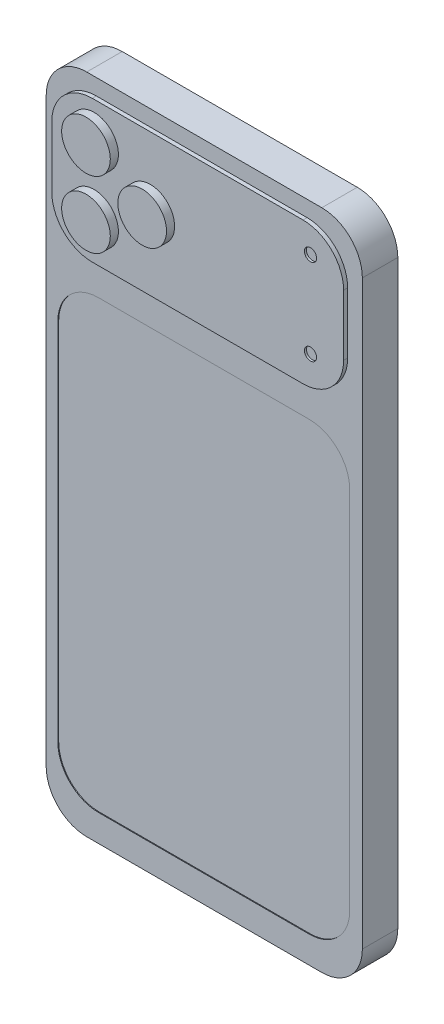
from build123d import *

# Parameters (mm, degrees)
BOSS_EXTRU_1_DEPTH      = 8.75
BOSS_EXTRU_2_DEPTH      = 1
ESQUISSE5_R             = 6
BOSS_EXTRU_3_DEPTH      = 2
ESQUISSE6_R             = 1.5
ENL_V_MAT_EXTRU_1_DEPTH = 0.5
ENL_V_MAT_EXTRU_2_DEPTH = 0.2


with BuildPart() as part:
    # Esquisse2 → Boss.-Extru.1 (new body)
    with BuildSketch(Plane.XY):
        with BuildLine():
            Line((10, 0), (68, 0))
            ThreePointArc((68, 0), (75.071067812, 2.928932188), (78, 10))
            Line((78, 10), (78, 153.4))
            ThreePointArc((78, 153.4), (75.071067812, 160.471067812), (68, 163.4))
            Line((68, 163.4), (10, 163.4))
            ThreePointArc((10, 163.4), (2.928932188, 160.471067812), (0, 153.4))
            Line((0, 153.4), (0, 10))
            ThreePointArc((0, 10), (2.928932188, 2.928932188), (10, 0))
        make_face()
    extrude(amount=BOSS_EXTRU_1_DEPTH)

    # Esquisse4 → Boss.-Extru.2 (add)
    with BuildSketch(Plane.XY.offset(8.75)):
        with BuildLine():
            Line((12.375884012, 159.465412193), (64.375884012, 159.465412193))
            ThreePointArc((64.375884012, 159.465412193), (71.446951823, 156.536480005), (74.375884012, 149.465412193))
            Line((74.375884012, 149.465412193), (74.375884012, 134.465412193))
            ThreePointArc((74.375884012, 134.465412193), (71.446951823, 127.394344381), (64.375884012, 124.465412193))
            Line((64.375884012, 124.465412193), (12.375884012, 124.465412193))
            ThreePointArc((12.375884012, 124.465412193), (5.3048162, 127.394344381), (2.375884012, 134.465412193))
            Line((2.375884012, 134.465412193), (2.375884012, 149.465412193))
            ThreePointArc((2.375884012, 149.465412193), (5.3048162, 156.536480005), (12.375884012, 159.465412193))
        make_face()
    extrude(amount=BOSS_EXTRU_2_DEPTH)

    # Esquisse5 → Boss.-Extru.3 (add)
    with BuildSketch(Plane.XY.offset(9.75)):
        with Locations((12.817579428, 150.680282261)):
            Circle(ESQUISSE5_R)
        with Locations((26.680664603, 142.232464732)):
            Circle(ESQUISSE5_R)
        with Locations((12.817579428, 134.217868615)):
            Circle(ESQUISSE5_R)
    extrude(amount=BOSS_EXTRU_3_DEPTH)

    # Esquisse6 → Enlèv. mat.-Extru.1 (cut)
    with BuildSketch(Plane.XY.offset(9.75)):
        with Locations((66.209801176, 152.964938364)):
            Circle(ESQUISSE6_R)
        with Locations((66.209801176, 131.745411373)):
            Circle(ESQUISSE6_R)
    extrude(amount=-ENL_V_MAT_EXTRU_1_DEPTH, mode=Mode.SUBTRACT)

    # Esquisse9 → Enlèv. mat.-Extru.2 (cut)
    with BuildSketch(Plane.XY.offset(8.75)):
        with BuildLine():
            Line((12.887963043, 116.636129809), (64.887963043, 116.636129809))
            ThreePointArc((64.887963043, 116.636129809), (71.959030855, 113.707197621), (74.887963043, 106.636129809))
            Line((74.887963043, 106.636129809), (74.887963043, 16.636129809))
            ThreePointArc((74.887963043, 16.636129809), (71.959030855, 9.565061997), (64.887963043, 6.636129809))
            Line((64.887963043, 6.636129809), (12.887963043, 6.636129809))
            ThreePointArc((12.887963043, 6.636129809), (5.816895231, 9.565061997), (2.887963043, 16.636129809))
            Line((2.887963043, 16.636129809), (2.887963043, 106.636129809))
            ThreePointArc((2.887963043, 106.636129809), (5.816895231, 113.707197621), (12.887963043, 116.636129809))
        make_face()
    extrude(amount=-ENL_V_MAT_EXTRU_2_DEPTH, mode=Mode.SUBTRACT)


solid = part.part
